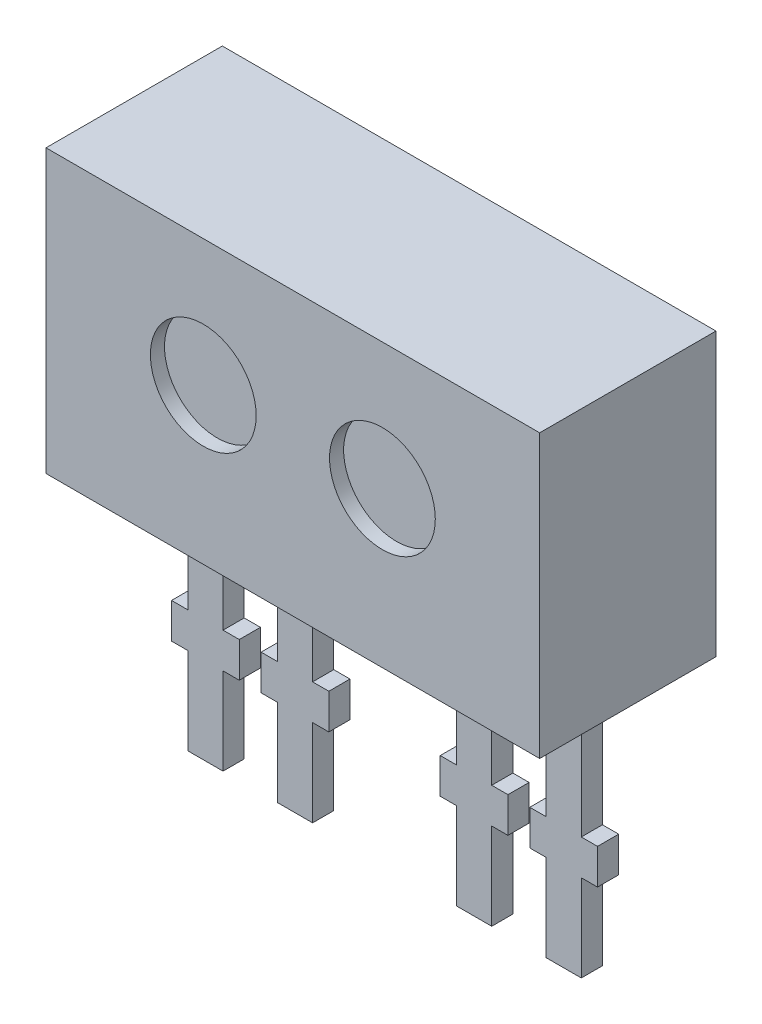
from build123d import *

# Parameters (mm, degrees)
SKETCH1_W                = 7
SKETCH1_H                = 4
BOSS_EXTRUDE1_DEPTH      = 2.5
SKETCH2_R                = 0.75
CUT_EXTRUDE1_DEPTH       = 0.2
BOSS_EXTRUDE2_DEPTH      = 3.5
BOSS_EXTRUDE2_DEPTH_BACK = 3.5
SKETCH3_W                = 0.3
SKETCH3_H                = 3.7
CUT_EXTRUDE2_DEPTH       = 8.140728254
CUT_EXTRUDE2_DEPTH_BACK  = 8.140728254


with BuildPart() as part:
    # Sketch1 → Boss-Extrude1 (new body)
    with BuildSketch(Plane.XY):
        Rectangle(SKETCH1_W, SKETCH1_H)
    extrude(amount=BOSS_EXTRUDE1_DEPTH)

    # Sketch2 → Cut-Extrude1 (cut)
    with BuildSketch(Plane.XY.offset(2.5)):
        with Locations((-1.27, 0.2)):
            Circle(SKETCH2_R)
        with Locations((1.27, 0.2)):
            Circle(SKETCH2_R)
    extrude(amount=-CUT_EXTRUDE1_DEPTH, mode=Mode.SUBTRACT)

    # Sketch3 → Boss-Extrude2 (add, two sides: drawn at the far end of the back side and taken through both)
    with BuildSketch(Plane(origin=(0, 0, 0), x_dir=(0, 0, -1), z_dir=(1, 0, 0)).offset(-BOSS_EXTRUDE2_DEPTH_BACK)):
        with Locations((-1.05, -3.85)):
            Rectangle(SKETCH3_W, SKETCH3_H)
    extrude(amount=BOSS_EXTRUDE2_DEPTH + BOSS_EXTRUDE2_DEPTH_BACK)

    # Sketch4 → Cut-Extrude2 (cut, two sides: drawn at the far end of the back side and taken through both)
    with BuildSketch(Plane.XY.offset(-CUT_EXTRUDE2_DEPTH_BACK)):
        Polygon((-2.79, -6.068420348), (-2.79, -4.468420348), (-3.020094846, -4.468420348), (-3.020094846, -3.968420348), (-2.79, -3.968420348), (-2.79, -2), (-4.136093054, -2), (-4.136093054, -6.068420348), align=None)
        Polygon((-2.29, -6.068420348), (-2.29, -4.468420348), (-2.059905154, -4.468420348), (-2.059905154, -3.968420348), (-2.29, -3.968420348), (-2.29, -2), (-1.52, -2), (-1.52, -3.968420348), (-1.750094846, -3.968420348), (-1.750094846, -4.468420348), (-1.52, -4.468420348), (-1.52, -6.068420348), align=None)
        Polygon((-1.02, -2), (1.02, -2), (1.02, -3.968420348), (0.789905154, -3.968420348), (0.789905154, -4.468420348), (1.02, -4.468420348), (1.02, -6.068420348), (-1.02, -6.068420348), (-1.02, -4.468420348), (-0.789905154, -4.468420348), (-0.789905154, -3.968420348), (-1.02, -3.968420348), align=None)
        Polygon((4.136093054, -6.068420348), (2.79, -6.068420348), (2.79, -4.468420348), (3.020094846, -4.468420348), (3.020094846, -3.968420348), (2.79, -3.968420348), (2.79, -2), (4.136093054, -2), align=None)
        Polygon((1.52, -6.068420348), (1.52, -4.468420348), (1.750094846, -4.468420348), (1.750094846, -3.968420348), (1.52, -3.968420348), (1.52, -2), (2.29, -2), (2.29, -3.968420348), (2.059905154, -3.968420348), (2.059905154, -4.468420348), (2.29, -4.468420348), (2.29, -6.068420348), align=None)
    extrude(amount=CUT_EXTRUDE2_DEPTH + CUT_EXTRUDE2_DEPTH_BACK, mode=Mode.SUBTRACT)


solid = part.part
